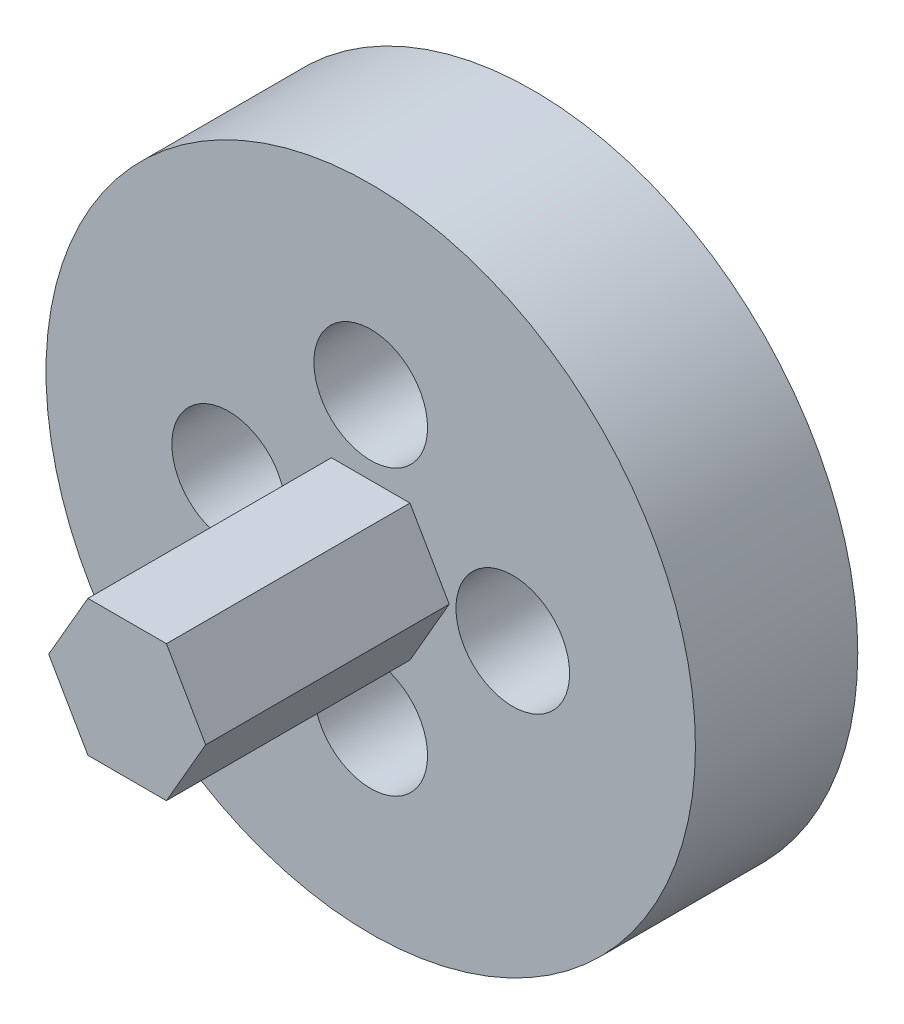
from build123d import *

# Parameters (mm, degrees)
SKETCH1_R           = 10
SKETCH1_R_2         = 1.65
BOSS_EXTRUDE1_DEPTH = 2
SKETCH2_R           = 16
BOSS_EXTRUDE2_DEPTH = 8
BOSS_EXTRUDE3_DEPTH = 12
SKETCH4_R           = 1.65
CUT_EXTRUDE1_DEPTH  = 12
SKETCH5_R           = 2.8
CUT_EXTRUDE2_DEPTH  = 5.6


with BuildPart() as part:
    # Sketch1 → Boss-Extrude1 (new body)
    with BuildSketch(Plane.XY):
        Circle(SKETCH1_R)
        with Locations((0, 7)):
            Circle(SKETCH1_R_2, mode=Mode.SUBTRACT)
        with Locations((7, 0)):
            Circle(SKETCH1_R_2, mode=Mode.SUBTRACT)
        with Locations((0, -7)):
            Circle(SKETCH1_R_2, mode=Mode.SUBTRACT)
        with Locations((-7, 0)):
            Circle(SKETCH1_R_2, mode=Mode.SUBTRACT)
    extrude(amount=BOSS_EXTRUDE1_DEPTH)

    # Sketch2 → Boss-Extrude2 (add)
    with BuildSketch(Plane.XY.offset(2)):
        Circle(SKETCH2_R)
    extrude(amount=BOSS_EXTRUDE2_DEPTH)

    # Sketch3 → Boss-Extrude3 (add)
    with BuildSketch(Plane.XY.offset(10)):
        Polygon((3.868246804, 0), (1.934123402, 3.35), (-1.934123402, 3.35), (-3.868246804, 0), (-1.934123402, -3.35), (1.934123402, -3.35), align=None)
    extrude(amount=BOSS_EXTRUDE3_DEPTH)

    # Sketch4 → Cut-Extrude1 (cut)
    with BuildSketch(Plane(origin=(0, 0, 0), x_dir=(-1, 0, 0), z_dir=(0, 0, -1))):
        with Locations(Location((0, -7, 0), (0, 0, 180))):
            Circle(SKETCH4_R)
        with Locations(Location((-7, 0, 0), (0, 0, 180))):
            Circle(SKETCH4_R)
        with Locations(Location((7, 0, 0), (0, 0, 180))):
            Circle(SKETCH4_R)
        with Locations(Location((0, 7, 0), (0, 0, 180))):
            Circle(SKETCH4_R)
    extrude(amount=-CUT_EXTRUDE1_DEPTH, mode=Mode.SUBTRACT)

    # Sketch5 → Cut-Extrude2 (cut)
    with BuildSketch(Plane.XY.offset(10)):
        with Locations((0, 7)):
            Circle(SKETCH5_R)
        with Locations((7, 0)):
            Circle(SKETCH5_R)
        with Locations((0, -7)):
            Circle(SKETCH5_R)
        with Locations((-7, 0)):
            Circle(SKETCH5_R)
    extrude(amount=-CUT_EXTRUDE2_DEPTH, mode=Mode.SUBTRACT)


solid = part.part
